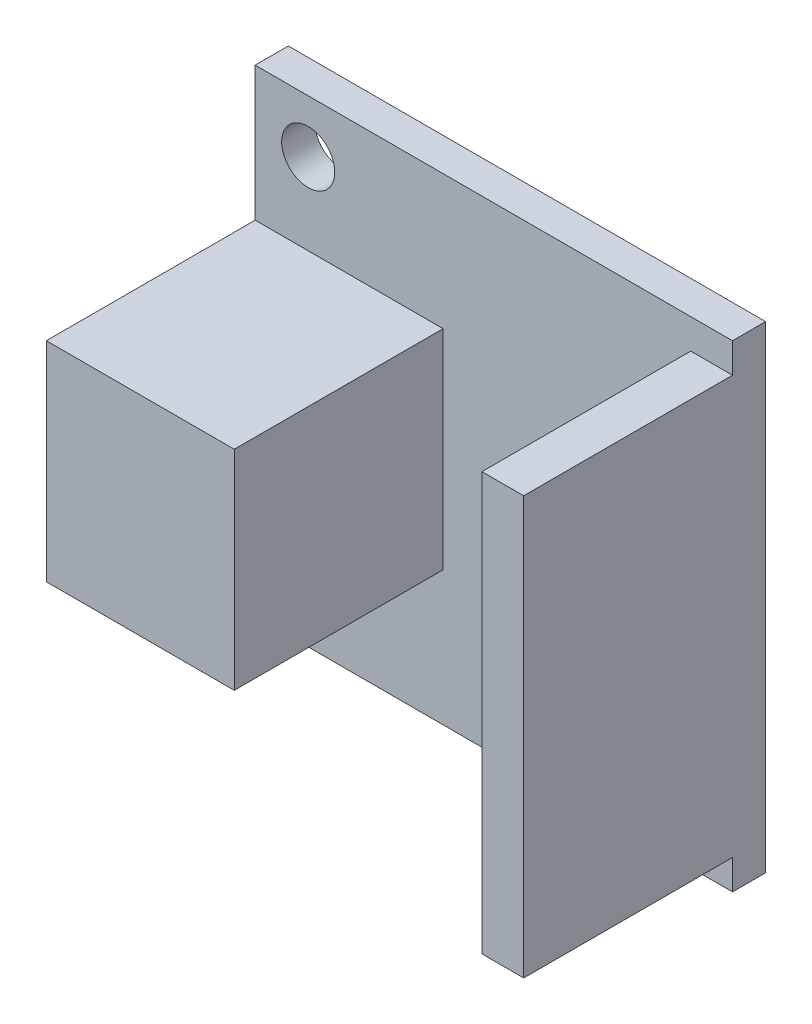
from build123d import *

# Parameters (mm, degrees)
SKETCH1_W           = 22.86
SKETCH1_H           = 22.86
BOSS_EXTRUDE1_DEPTH = 1.5875
SKETCH2_W           = 9
SKETCH2_H           = 10
BOSS_EXTRUDE2_DEPTH = 10
SKETCH4_W           = 2
SKETCH4_H           = 20
BOSS_EXTRUDE3_DEPTH = 10
SKETCH6_R           = 1.27
CUT_EXTRUDE1_DEPTH  = 20.007624786


with BuildPart() as part:
    # Sketch1 → Boss-Extrude1 (new body)
    with BuildSketch(Plane.XY):
        Rectangle(SKETCH1_W, SKETCH1_H)
    extrude(amount=BOSS_EXTRUDE1_DEPTH)

    # Sketch2 → Boss-Extrude2 (add)
    with BuildSketch(Plane.XY.offset(1.5875)):
        with Locations((-6.93, 0)):
            Rectangle(SKETCH2_W, SKETCH2_H)
    extrude(amount=BOSS_EXTRUDE2_DEPTH)

    # Sketch4 → Boss-Extrude3 (add)
    with BuildSketch(Plane.XY.offset(1.5875)):
        with Locations((10.43, 0)):
            Rectangle(SKETCH4_W, SKETCH4_H)
    extrude(amount=BOSS_EXTRUDE3_DEPTH)

    # Sketch6 → Cut-Extrude1 (cut, through all)
    with BuildSketch(Plane.XY.offset(1.5875)):
        with Locations((-8.89, 8.89)):
            Circle(SKETCH6_R)
        with Locations((-8.89, -8.89)):
            Circle(SKETCH6_R)
    extrude(amount=-CUT_EXTRUDE1_DEPTH, mode=Mode.SUBTRACT)


solid = part.part
